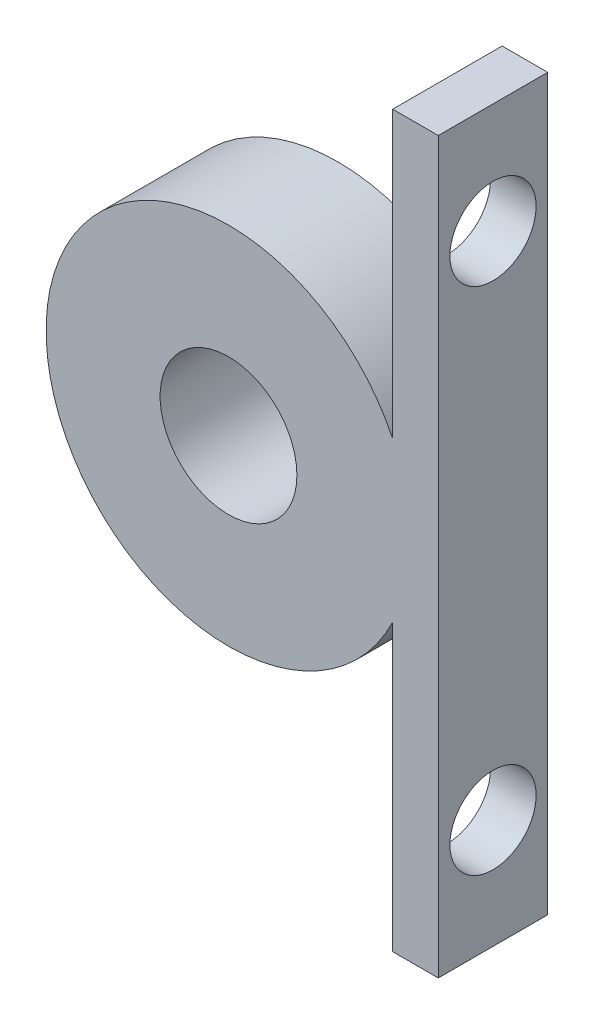
from build123d import *

# Parameters (mm, degrees)
SKETCH1_R           = 12.7
SKETCH1_R_2         = 4.7625
SKETCH1_W           = 3.175
SKETCH1_H           = 50.8
BOSS_EXTRUDE1_DEPTH = 7.62
CUT_EXTRUDE1_DEPTH  = 7.62


with BuildPart() as part:
    # Sketch1 → Boss-Extrude1 (new body)
    # profile 1 of 2: a face of its own
    with BuildSketch(Plane.XY):
        with Locations((-11.43, -2.615954226)):
            Circle(SKETCH1_R)
        with Locations((-11.43, -2.615954226)):
            Circle(SKETCH1_R_2, mode=Mode.SUBTRACT)
    # profile 2 of 2: a face of its own
    with BuildSketch(Plane.XY):
        with Locations((1.5875, -2.615954226)):
            Rectangle(SKETCH1_W, SKETCH1_H)
    extrude(amount=BOSS_EXTRUDE1_DEPTH)

    # Sketch3 → Cut-Extrude1 (cut)
    with BuildSketch(Plane(origin=(5.715, 0, 0), x_dir=(0, 0, -1), z_dir=(1, 0, 0))):
        with BuildLine():
            ThreePointArc((-0.81, 15.116671426), (-1.688679656, 17.237991769), (-3.81, 18.116671426))
            Line((-3.81, 18.116671426), (-3.81, 15.116671426))
            Line((-3.81, 15.116671426), (-3.81, 12.116671426))
            ThreePointArc((-3.81, 12.116671426), (-1.688679656, 12.995351082), (-0.81, 15.116671426))
        make_face()
        with BuildLine():
            Line((-3.81, 15.116671426), (-3.81, 18.116671426))
            ThreePointArc((-3.81, 18.116671426), (-6.81, 15.116671426), (-3.81, 12.116671426))
            Line((-3.81, 12.116671426), (-3.81, 15.116671426))
        make_face()
        with BuildLine():
            ThreePointArc((-0.81, -20.395954226), (-1.688679656, -18.274633882), (-3.81, -17.395954226))
            Line((-3.81, -17.395954226), (-3.81, -20.395954226))
            Line((-3.81, -20.395954226), (-3.81, -23.395954226))
            ThreePointArc((-3.81, -23.395954226), (-1.688679656, -22.517274569), (-0.81, -20.395954226))
        make_face()
        with BuildLine():
            Line((-3.81, -20.395954226), (-3.81, -17.395954226))
            ThreePointArc((-3.81, -17.395954226), (-6.81, -20.395954226), (-3.81, -23.395954226))
            Line((-3.81, -23.395954226), (-3.81, -20.395954226))
        make_face()
    extrude(amount=-CUT_EXTRUDE1_DEPTH, mode=Mode.SUBTRACT)


solid = part.part
